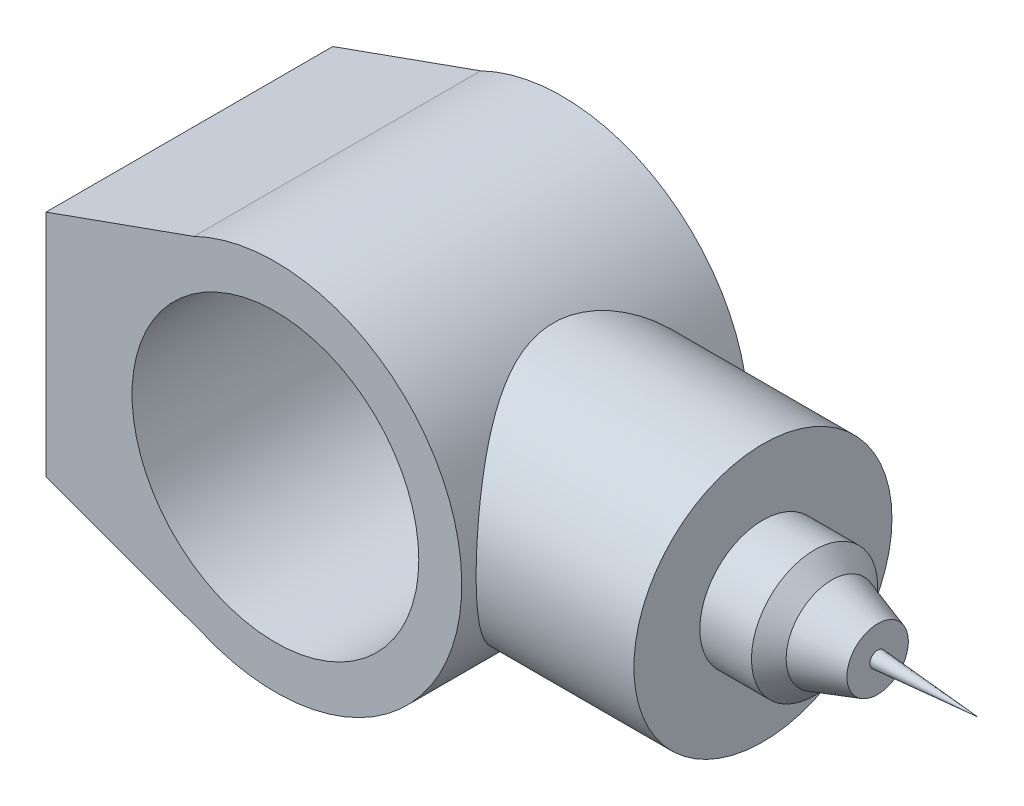
from build123d import *

# Parameters (mm, degrees)
SKETCH1_R                = 500
BOSS_EXTRUDE1_DEPTH      = 500
BOSS_EXTRUDE2_REACH      = 2163.597
BOSS_EXTRUDE2_END_RADIUS = 650
SKETCH2_R                = 450


with BuildPart() as part:
    # Sketch1 → Boss-Extrude1 (new, symmetric)
    with BuildSketch(Plane.XY):
        with BuildLine():
            Line((-800, 400), (-800, -400))
            Line((-800, -400), (-256.343570219, -597.317314338))
            ThreePointArc((-256.343570219, -597.317314338), (649.817878656, 15.385856465), (-284.326048032, 584.515781147))
            Line((-284.326048032, 584.515781147), (-800, 400))
        make_face()
        Circle(SKETCH1_R, mode=Mode.SUBTRACT)
    extrude(amount=BOSS_EXTRUDE1_DEPTH, both=True)

    # Boss-Extrude2: up to this cylinder (the profile starts outside it)
    boss_extrude2_end = Plane(origin=(0, 0, 0), z_dir=(0, 0, -1)) * Cylinder(BOSS_EXTRUDE2_END_RADIUS, 5628.194, mode=Mode.PRIVATE)
    # Sketch2 → Boss-Extrude2 (add, up to the surface)
    with BuildSketch(Plane(origin=(1200, 0, 0), x_dir=(0, 0, -1), z_dir=(1, 0, 0)), mode=Mode.PRIVATE) as boss_extrude2_sk1:
        Circle(SKETCH2_R)
    boss_extrude2_tool1 = extrude(boss_extrude2_sk1.sketch, amount=-BOSS_EXTRUDE2_REACH, mode=Mode.PRIVATE) - boss_extrude2_end
    add(boss_extrude2_tool1.solids().sort_by_distance((1200, 0, 0))[0])

    # Sketch3 → Revolve2 (revolve)
    with BuildSketch(Plane.XY, mode=Mode.PRIVATE) as revolve2_sk:
        Polygon((1200, 0), (1200, -220), (1380, -220), (1440, -159.056741035), (1600, -107.069589638), (1600, -27.069589638), (1950, 0), align=None)
    revolve(revolve2_sk.sketch.rotate(Axis((0, 0, 0), (1, 0, 0)), 270), axis=Axis((0, 0, 0), (1, 0, 0)))


solid = part.part
